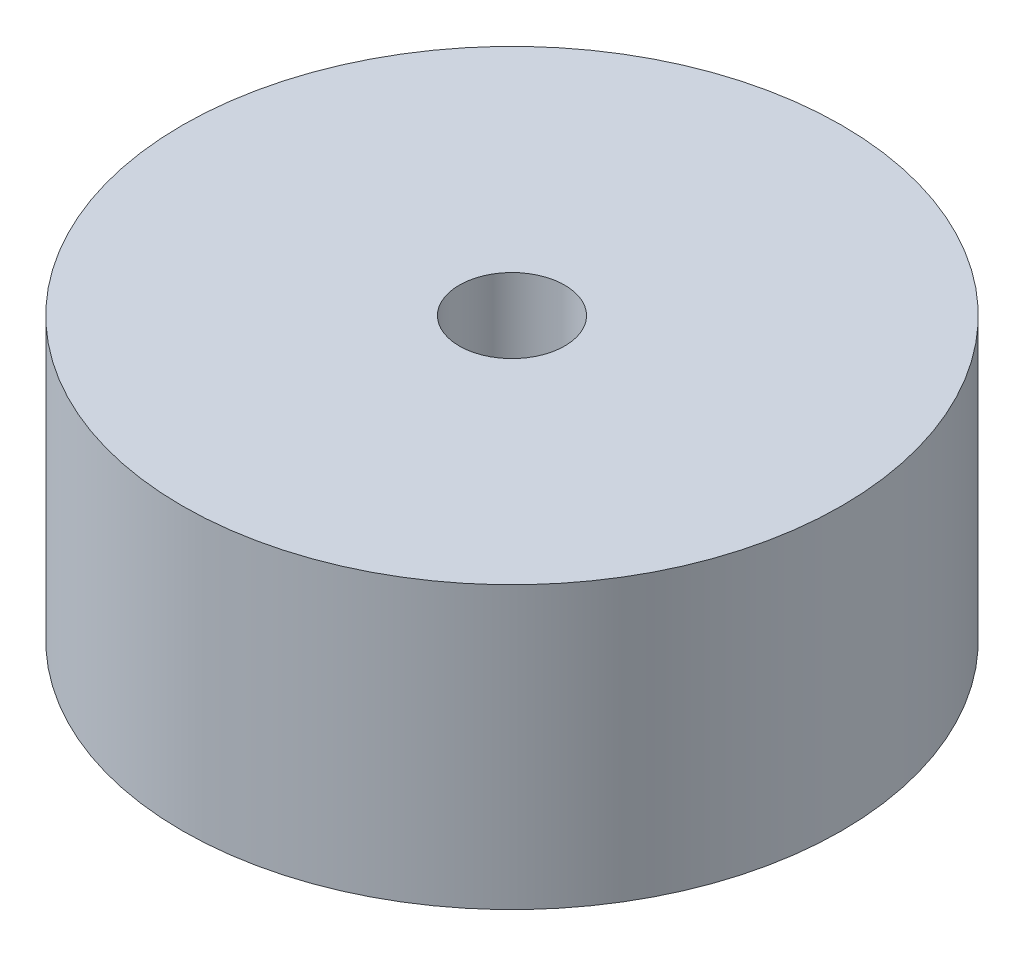
from build123d import *

# Parameters (mm, degrees)
SKETCH_1_R      = 37.5
SKETCH_1_R_2    = 6
EXTRUDE_1_DEPTH = 32


with BuildPart() as part:
    # 草图1 → 凸台-拉伸1 (new body)
    with BuildSketch(Plane(origin=(0, 0, 0), x_dir=(1, 0, 0), z_dir=(0, 1, 0))):
        with Locations(Location((0, 0, 0), (0, 0, 270))):
            Circle(SKETCH_1_R)
        with Locations(Location((0, 0, 0), (0, 0, 270))):
            Circle(SKETCH_1_R_2, mode=Mode.SUBTRACT)
    extrude(amount=EXTRUDE_1_DEPTH)


solid = part.part
